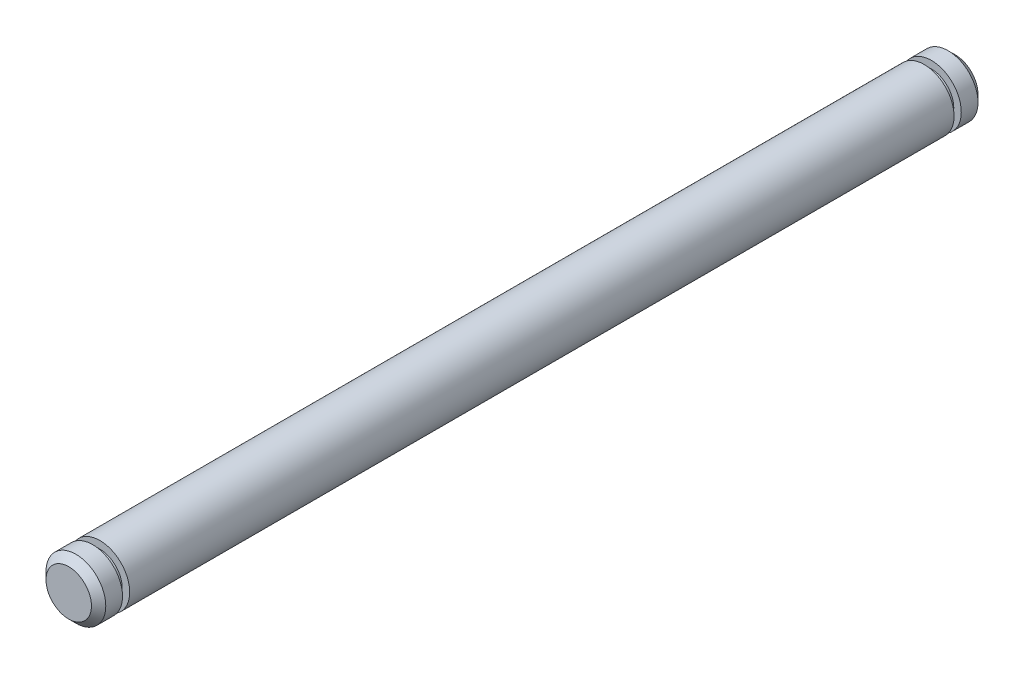
from build123d import *

# Parameters (mm, degrees)
SKETCH1_R                = 1.5875
BOSS_EXTRUDE1_DEPTH      = 21.89226
SKETCH2_R                = 1.19126
BOSS_EXTRUDE2_DEPTH      = 0.381
BOSS_EXTRUDE3_START      = 1.27
SKETCH3_R                = 1.5875
BOSS_EXTRUDE3_DEPTH      = 1.27
CHAMFER1_SIZE            = 0.381
CHAMFER1_OF_MIRROR1_SIZE = 0.381


with BuildPart() as part:
    # Sketch1 → Boss-Extrude1 (new, symmetric)
    with BuildSketch(Plane.XY):
        with Locations(Location((0, 0, 0), (0, 0, 180))):
            Circle(SKETCH1_R)
    extrude(amount=BOSS_EXTRUDE1_DEPTH, both=True)

    # Sketch2 → Boss-Extrude2 (add)
    with BuildSketch(Plane.XY.offset(21.89226)):
        with Locations(Location((0, 0, 0), (0, 0, 180))):
            Circle(SKETCH2_R)
    boss_extrude2 = extrude(amount=BOSS_EXTRUDE2_DEPTH)

    # Sketch3 → Boss-Extrude3 (add)
    with BuildSketch(Plane.XY.offset(22.27326).offset(BOSS_EXTRUDE3_START)):
        with Locations(Location((0, 0, 0), (0, 0, 180))):
            Circle(SKETCH3_R)
    boss_extrude3 = extrude(amount=-BOSS_EXTRUDE3_DEPTH)

    # Chamfer1
    chamfer1_edges = [part.edges().sort_by_distance(p)[0] for p in [
        (1.5875, 0, 23.54326),
    ]]
    chamfer(chamfer1_edges, length=CHAMFER1_SIZE)

    # Mirror1: Boss-Extrude2, Boss-Extrude3 across plane
    add(boss_extrude2.mirror(Plane.XY))
    add(boss_extrude3.mirror(Plane.XY))

    # Chamfer1 of Mirror1
    chamfer1_of_mirror1_edges = [part.edges().sort_by_distance(p)[0] for p in [
        (1.5875, 0, -23.54326),
    ]]
    chamfer(chamfer1_of_mirror1_edges, length=CHAMFER1_OF_MIRROR1_SIZE)


solid = part.part
